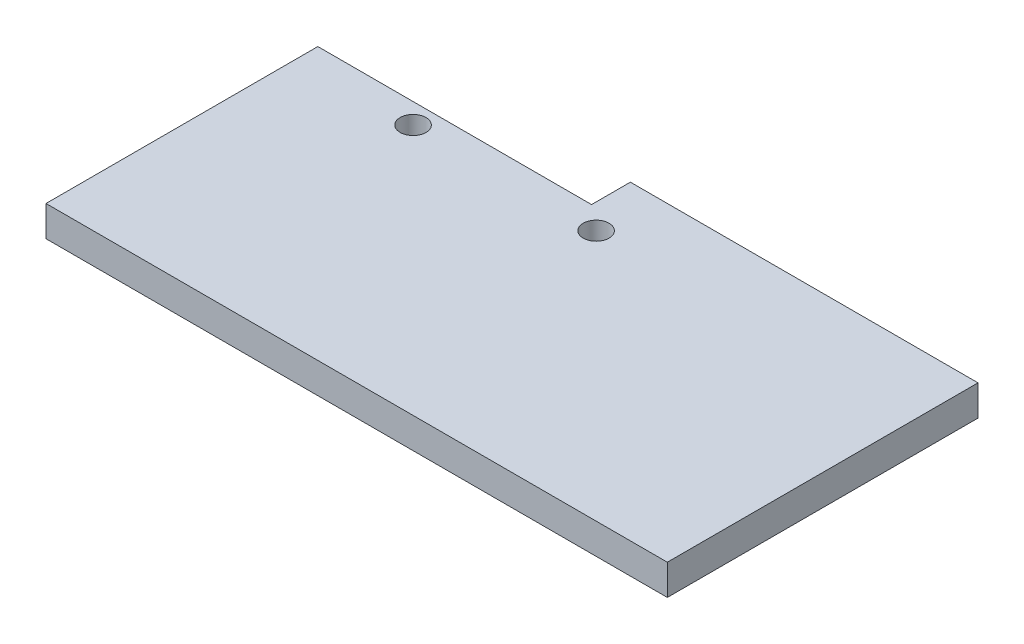
from build123d import *

# Parameters (mm, degrees)
SKETCH1_W      = 1219.2
SKETCH1_H      = 609.6
EXTRUDE1_DEPTH = 59.944
SKETCH9_W      = 641.290586706
SKETCH9_H      = 96.25128706
EXTRUDE2_DEPTH = 1304.139971926
SKETCH10_R     = 25.4
EXTRUDE3_DEPTH = 1304.139971926


with BuildPart() as part:
    # Sketch1 → Extrude1 (new body)
    with BuildSketch(Plane(origin=(0, 0, 0), x_dir=(1, 0, 0), z_dir=(0, 1, 0))):
        with Locations((558.660869819, -269.436051937)):
            Rectangle(SKETCH1_W, SKETCH1_H)
    extrude(amount=EXTRUDE1_DEPTH)

    # Sketch9 → Extrude2 (cut, through all)
    with BuildSketch(Plane(origin=(0, 59.944, 0), x_dir=(1, 0, 0), z_dir=(0, 1, 0))):
        with Locations((165.530071427, 7.289591593)):
            Rectangle(SKETCH9_W, SKETCH9_H)
    extrude(amount=-EXTRUDE2_DEPTH, mode=Mode.SUBTRACT)

    # Sketch10 → Extrude3 (cut, through all)
    with BuildSketch(Plane(origin=(0, 59.944, 0), x_dir=(1, 0, 0), z_dir=(0, 1, 0))):
        with Locations((175.855747398, -80.741174358)):
            Circle(SKETCH10_R)
        with Locations((535.065992241, -80.741174358)):
            Circle(SKETCH10_R)
    extrude(amount=-EXTRUDE3_DEPTH, mode=Mode.SUBTRACT)


solid = part.part
